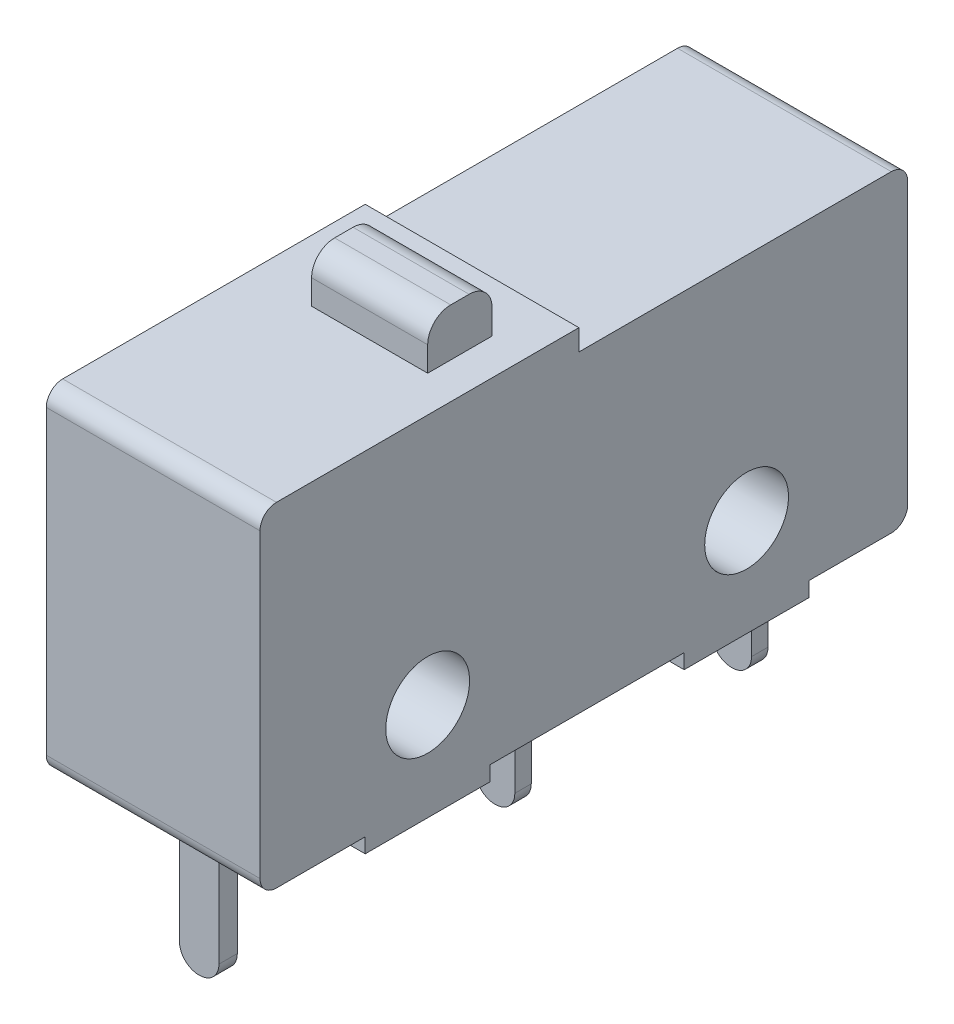
from build123d import *

# Parameters (mm, degrees)
SKETCH1_R           = 1.275
BOSS_EXTRUDE1_DEPTH = 6.5
SKETCH2_W           = 3.53
SKETCH2_H           = 1.96
BOSS_EXTRUDE2_DEPTH = 1.45
FILLET1_R           = 0.7
SKETCH3_W           = 3.2
SKETCH3_H           = 0.56
SKETCH3_H_2         = 0.5
BOSS_EXTRUDE3_DEPTH = 0.9
SKETCH4_W           = 1.2
SKETCH4_H           = 0.56
SKETCH4_H_2         = 0.5
BOSS_EXTRUDE4_DEPTH = 3.47
FILLET2_R           = 0.59


with BuildPart() as part:
    # Sketch1 → Boss-Extrude1 (new body)
    with BuildSketch(Plane(origin=(0, 0, 0), x_dir=(0, 0, -1), z_dir=(1, 0, 0))):
        with BuildLine():
            Line((-37.373122581, 0), (-34.673122581, 0))
            Line((-34.673122581, 0), (-34.673122581, -0.45))
            Line((-34.673122581, -0.45), (-30.873122581, -0.45))
            Line((-30.873122581, -0.45), (-30.873122581, 0))
            Line((-30.873122581, 0), (-24.973122581, 0))
            Line((-24.973122581, 0), (-24.973122581, -0.45))
            Line((-24.973122581, -0.45), (-21.173122581, -0.45))
            Line((-21.173122581, -0.45), (-21.173122581, 0))
            Line((-21.173122581, 0), (-18.673122581, 0))
            ThreePointArc((-18.673122581, 0), (-18.31956919, 0.146446609), (-18.173122581, 0.5))
            Line((-18.173122581, 0.5), (-18.173122581, 9.02))
            ThreePointArc((-18.173122581, 9.02), (-18.31956919, 9.373553391), (-18.673122581, 9.52))
            Line((-18.673122581, 9.52), (-28.173122581, 9.52))
            Line((-28.173122581, 9.52), (-28.173122581, 10.16))
            Line((-28.173122581, 10.16), (-37.373122581, 10.16))
            ThreePointArc((-37.373122581, 10.16), (-37.726675972, 10.013553391), (-37.873122581, 9.66))
            Line((-37.873122581, 9.66), (-37.873122581, 0.5))
            ThreePointArc((-37.873122581, 0.5), (-37.726675972, 0.146446609), (-37.373122581, 0))
        make_face()
        with Locations(Location((-32.773122581, 2.525, 0), (0, 0, 180))):
            Circle(SKETCH1_R, mode=Mode.SUBTRACT)
        with Locations(Location((-23.073122581, 2.525, 0), (0, 0, 180))):
            Circle(SKETCH1_R, mode=Mode.SUBTRACT)
    extrude(amount=BOSS_EXTRUDE1_DEPTH)

    # Sketch2 → Boss-Extrude2 (add)
    with BuildSketch(Plane(origin=(0, 10.16, 0), x_dir=(1, 0, 0), z_dir=(0, 1, 0))):
        with Locations((3.635, -30.693122581)):
            Rectangle(SKETCH2_W, SKETCH2_H)
    extrude(amount=BOSS_EXTRUDE2_DEPTH)

    # Fillet1
    fillet1_edges = [part.edges().sort_by_distance(p)[0] for p in [
        (3.635, 11.61, 31.673122581),
        (3.635, 11.61, 29.713122581),
    ]]
    fillet(fillet1_edges, radius=FILLET1_R)

    # Sketch3 → Boss-Extrude3 (add)
    with BuildSketch(Plane(origin=(0, 0, 0), x_dir=(-1, 0, 0), z_dir=(0, -1, 0))):
        with Locations((-3.25, -36.193122581)):
            Rectangle(SKETCH3_W, SKETCH3_H)
        with Locations((-3.25, -27.223122581)):
            Rectangle(SKETCH3_W, SKETCH3_H_2)
        with Locations((-3.25, -20.023122581)):
            Rectangle(SKETCH3_W, SKETCH3_H_2)
    extrude(amount=BOSS_EXTRUDE3_DEPTH)

    # Sketch4 → Boss-Extrude4 (add)
    with BuildSketch(Plane(origin=(0, -0.9, 0), x_dir=(-1, 0, 0), z_dir=(0, -1, 0))):
        with Locations((-3.25, -36.193122581)):
            Rectangle(SKETCH4_W, SKETCH4_H)
        with Locations((-3.25, -27.223122581)):
            Rectangle(SKETCH4_W, SKETCH4_H_2)
        with Locations((-3.25, -20.023122581)):
            Rectangle(SKETCH4_W, SKETCH4_H_2)
    extrude(amount=BOSS_EXTRUDE4_DEPTH)

    # Fillet2
    fillet2_edges = [part.edges().sort_by_distance(p)[0] for p in [
        (2.65, -4.37, 36.193122581),
        (3.85, -4.37, 36.193122581),
        (2.65, -4.37, 27.223122581),
        (3.85, -4.37, 27.223122581),
        (3.85, -4.37, 20.023122581),
        (2.65, -4.37, 20.023122581),
    ]]
    fillet(fillet2_edges, radius=FILLET2_R)


solid = part.part
